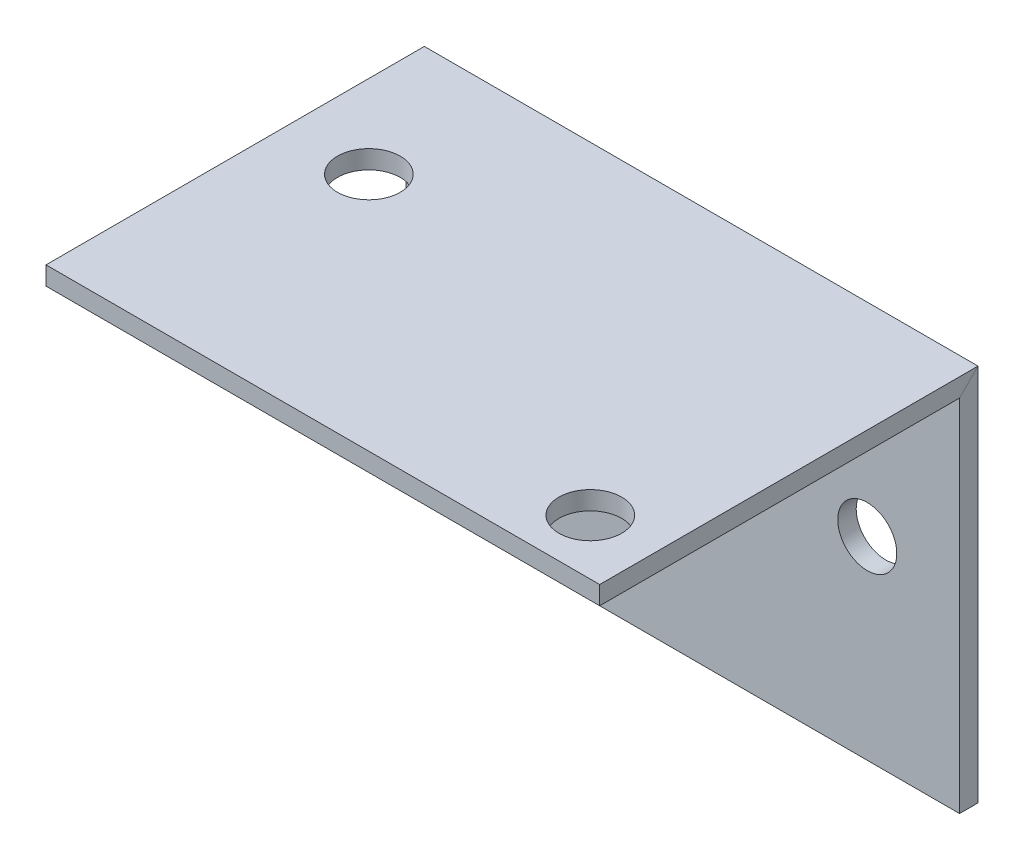
from build123d import *

# Parameters (mm, degrees)
ESQUISSE1_W             = 30
ESQUISSE1_H             = 1
ESQUISSE7_R             = 1.7
ENL_V_MAT_EXTRU_1_DEPTH = 33.023428923
ESQUISSE8_R             = 1.6
ENL_V_MAT_EXTRU_2_DEPTH = 32.705677725


with BuildPart() as part:
    # Balayage1: sweep along a path in Esquisse6
    with BuildLine(Plane(origin=(0, 0, 0), x_dir=(0, 0, -1), z_dir=(1, 0, 0))) as balayage1_path:
        Line((0, 0), (20, 0))
        Line((20, 0), (20, -20))
    # Esquisse1 → Balayage1 (sweep)
    with BuildSketch(Plane.XY):
        Rectangle(ESQUISSE1_W, ESQUISSE1_H)
    sweep(path=balayage1_path.line, transition=Transition.RIGHT)

    # Esquisse7 → Enlèv. mat.-Extru.1 (cut, through all)
    with BuildSketch(Plane.XZ.offset(0.5)):
        with Locations(Location((11.49340839, -3, 0), (0, 0, 270))):
            Circle(ESQUISSE7_R)
        with Locations(Location((-10.50659161, -13, 0), (0, 0, 270))):
            Circle(ESQUISSE7_R)
    extrude(amount=-ENL_V_MAT_EXTRU_1_DEPTH, mode=Mode.SUBTRACT)

    # Esquisse8 → Enlèv. mat.-Extru.2 (cut, through all)
    with BuildSketch(Plane.XY.offset(-19.5)):
        with Locations((-10, -9.5)):
            Circle(ESQUISSE8_R)
        with Locations(Location((10, -9.5, 0), (0, 0, 180))):
            Circle(ESQUISSE8_R)
    extrude(amount=-ENL_V_MAT_EXTRU_2_DEPTH, mode=Mode.SUBTRACT)


solid = part.part
